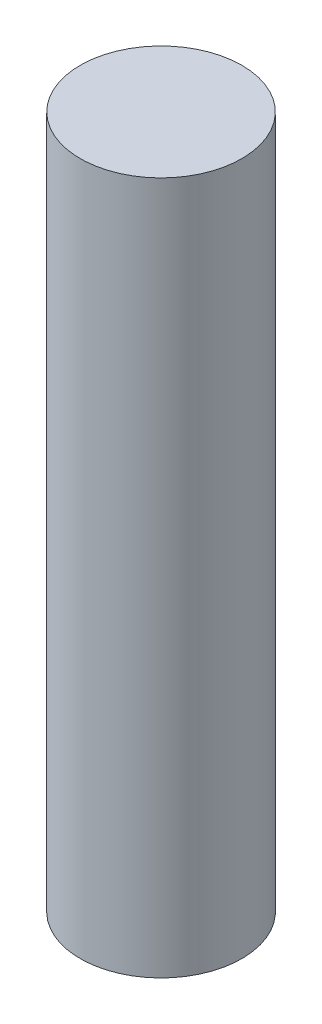
from build123d import *

# Parameters (mm, degrees)
SKETCH1_R           = 2.2225
BOSS_EXTRUDE1_DEPTH = 19.05


with BuildPart() as part:
    # Sketch1 → Boss-Extrude1 (new body)
    with BuildSketch(Plane(origin=(0, 0, 0), x_dir=(1, 0, 0), z_dir=(0, 1, 0))):
        with Locations(Location((0, 0, 0), (0, 0, 90))):
            Circle(SKETCH1_R)
    extrude(amount=BOSS_EXTRUDE1_DEPTH)


solid = part.part
